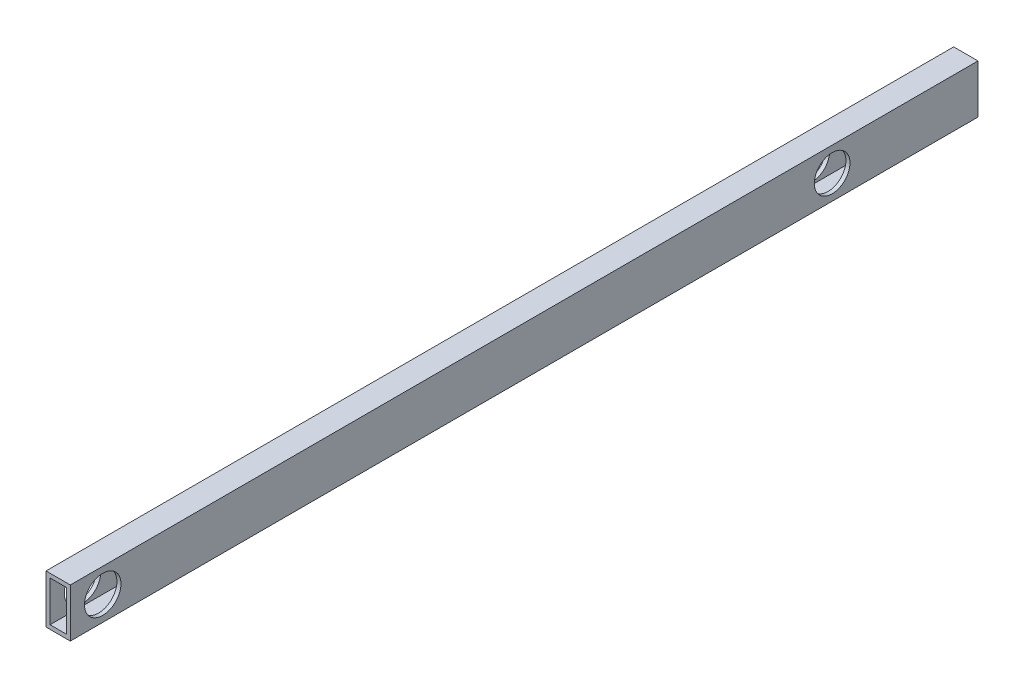
from build123d import *

# Parameters (mm, degrees)
SKETCH1_W           = 19.05
SKETCH1_H           = 38.1
SKETCH1_W_2         = 12.7
SKETCH1_H_2         = 31.75
EXTRUDE_THIN1_DEPTH = 711.2
SKETCH3_R           = 13.97
CUT_EXTRUDE2_DEPTH  = 713.474527615
SKETCH4_R           = 14.2875
CUT_EXTRUDE3_DEPTH  = 713.474527615


with BuildPart() as part:
    # Sketch1 → Extrude-Thin1 (new body)
    with BuildSketch(Plane.XY):
        with Locations((9.525, 19.05)):
            Rectangle(SKETCH1_W, SKETCH1_H)
        with Locations((9.525, 19.05)):
            Rectangle(SKETCH1_W_2, SKETCH1_H_2, mode=Mode.SUBTRACT)
    extrude(amount=EXTRUDE_THIN1_DEPTH)

    # Sketch3 → Cut-Extrude2 (cut, through all)
    with BuildSketch(Plane(origin=(19.05, 0, 0), x_dir=(0, 0, -1), z_dir=(1, 0, 0))):
        with Locations((-114.3, 19.05)):
            Circle(SKETCH3_R)
    extrude(amount=-CUT_EXTRUDE2_DEPTH, mode=Mode.SUBTRACT)

    # Sketch4 → Cut-Extrude3 (cut, through all)
    with BuildSketch(Plane(origin=(19.05, 0, 0), x_dir=(0, 0, -1), z_dir=(1, 0, 0))):
        with Locations((-685.8, 19.05)):
            Circle(SKETCH4_R)
    extrude(amount=-CUT_EXTRUDE3_DEPTH, mode=Mode.SUBTRACT)


solid = part.part
